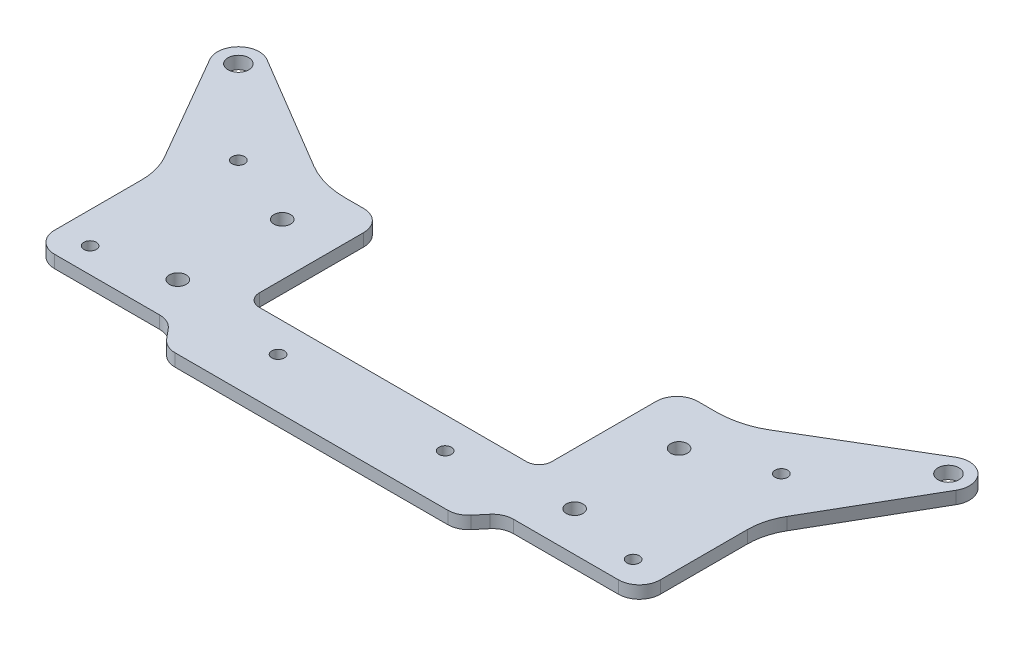
from build123d import *

# Parameters (mm, degrees)
SKETCH_1_R      = 2.5
SKETCH_1_R_2    = 2
SKETCH_1_R_3    = 1.5
EXTRUDE_1_DEPTH = 3
FILLET_1_R      = 20
FILLET_2_R      = 5


with BuildPart() as part:
    # 草图1 → 凸台-拉伸1 (new body)
    with BuildSketch(Plane(origin=(0, 0, 0), x_dir=(1, 0, 0), z_dir=(0, 1, 0))):
        with BuildLine():
            Line((-72.5, -61.5), (-40, -61.5))
            Line((-40, -61.5), (-34.965402213, -67.5))
            Line((-34.965402213, -67.5), (34.965402213, -67.5))
            Line((34.965402213, -67.5), (40, -61.5))
            Line((40, -61.5), (72.5, -61.5))
            Line((72.5, -61.5), (72.5, -35.669872981))
            ThreePointArc((72.5, -35.669872981), (73.011112606, -31.787587305), (74.509618943, -28.169872981))
            Line((74.509618943, -28.169872981), (89.330127019, -2.5))
            ThreePointArc((89.330127019, -2.5), (88.512514494, 3.558404408), (82.444008336, 4.297313883))
            Line((82.444008336, 4.297313883), (50, -15))
            Line((50, -15), (35, -15))
            Line((35, -15), (35, -45))
            ThreePointArc((35, -45), (34.121320344, -47.121320344), (32, -48))
            Line((32, -48), (-32, -48))
            ThreePointArc((-32, -48), (-34.121320344, -47.121320344), (-35, -45))
            Line((-35, -45), (-35, -15))
            Line((-35, -15), (-50, -15))
            Line((-50, -15), (-82.444008336, 4.297313883))
            ThreePointArc((-82.444008336, 4.297313883), (-88.512514494, 3.558404408), (-89.330127019, -2.5))
            Line((-89.330127019, -2.5), (-74.509618943, -28.169872981))
            ThreePointArc((-74.509618943, -28.169872981), (-73.011112606, -31.787587305), (-72.5, -35.669872981))
            Line((-72.5, -35.669872981), (-72.5, -61.5))
        make_face()
        with Locations(Location((85, 0, 0), (0, 0, 270))):
            Circle(SKETCH_1_R, mode=Mode.SUBTRACT)
        with Locations(Location((-85, 0, 0), (0, 0, 270))):
            Circle(SKETCH_1_R, mode=Mode.SUBTRACT)
        with Locations(Location((47.5, -27, 0), (0, 0, 270))):
            Circle(SKETCH_1_R_2, mode=Mode.SUBTRACT)
        with Locations(Location((47.5, -52, 0), (0, 0, 270))):
            Circle(SKETCH_1_R_2, mode=Mode.SUBTRACT)
        with Locations(Location((-47.5, -52, 0), (0, 0, 270))):
            Circle(SKETCH_1_R_2, mode=Mode.SUBTRACT)
        with Locations(Location((-47.5, -27, 0), (0, 0, 270))):
            Circle(SKETCH_1_R_2, mode=Mode.SUBTRACT)
        with Locations(Location((-20, -55.5, 0), (0, 0, 270))):
            Circle(SKETCH_1_R_3, mode=Mode.SUBTRACT)
        with Locations(Location((20, -55.5, 0), (0, 0, 270))):
            Circle(SKETCH_1_R_3, mode=Mode.SUBTRACT)
        with Locations(Location((65, -55.5, 0), (0, 0, 270))):
            Circle(SKETCH_1_R_3, mode=Mode.SUBTRACT)
        with Locations(Location((-65, -55.5, 0), (0, 0, 270))):
            Circle(SKETCH_1_R_3, mode=Mode.SUBTRACT)
        with Locations(Location((65, -20, 0), (0, 0, 270))):
            Circle(SKETCH_1_R_3, mode=Mode.SUBTRACT)
        with Locations(Location((-65, -20, 0), (0, 0, 270))):
            Circle(SKETCH_1_R_3, mode=Mode.SUBTRACT)
    extrude(amount=EXTRUDE_1_DEPTH)

    # 圆角1
    fillet_1_edges = [part.edges().sort_by_distance(p)[0] for p in [
        (50, 1.5, 15),
        (-50, 1.5, 15),
    ]]
    fillet(fillet_1_edges, radius=FILLET_1_R)

    # 圆角2
    fillet_2_edges = [part.edges().sort_by_distance(p)[0] for p in [
        (-35, 1.5, 15),
        (35, 1.5, 15),
        (72.5, 1.5, 61.5),
        (40, 1.5, 61.5),
        (34.965402213, 1.5, 67.5),
        (-34.965402213, 1.5, 67.5),
        (-40, 1.5, 61.5),
        (-72.5, 1.5, 61.5),
    ]]
    fillet(fillet_2_edges, radius=FILLET_2_R)


solid = part.part
